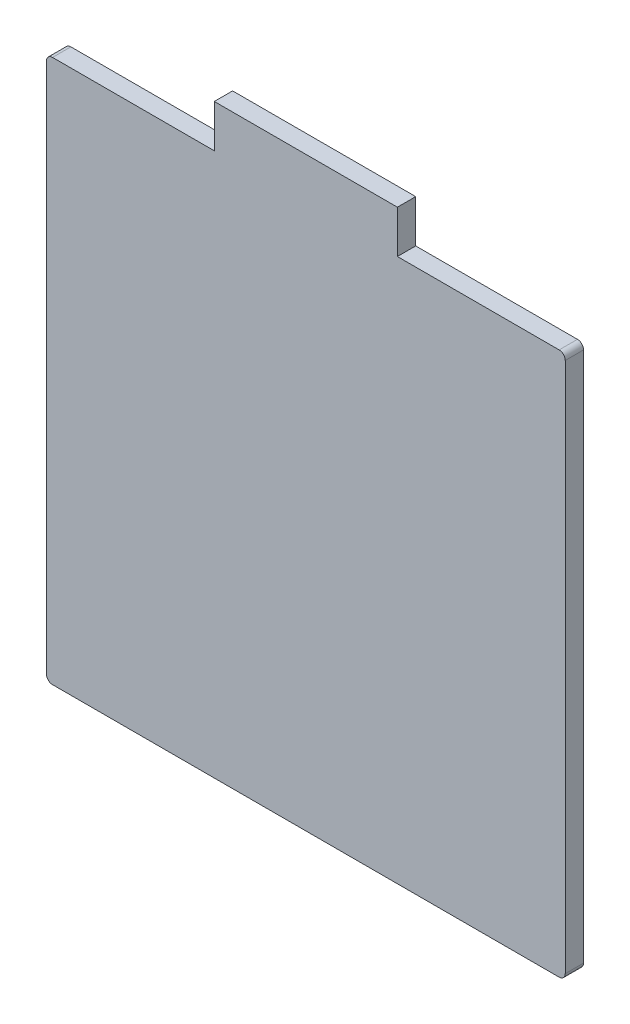
from build123d import *

# Parameters (mm, degrees)
SKETCH1_W           = 890
SKETCH1_H           = 850
BOSS_EXTRUDE1_DEPTH = 30
FILLET1_R           = 10
BOSS_EXTRUDE3_DEPTH = 70


with BuildPart() as part:
    # Sketch1 → Boss-Extrude1 (new body)
    with BuildSketch(Plane(origin=(0, 0, 0), x_dir=(0, 1, 0), z_dir=(0, 0, 1))):
        Rectangle(SKETCH1_W, SKETCH1_H)
    extrude(amount=BOSS_EXTRUDE1_DEPTH)

    # Fillet1
    fillet1_edges = [part.edges().sort_by_distance(p)[0] for p in [
        (-425, -445, 15),
        (-425, 445, 15),
        (425, 445, 15),
        (425, -445, 15),
    ]]
    fillet(fillet1_edges, radius=FILLET1_R)

    # Sketch3 → Boss-Extrude3 (add)
    with BuildSketch(Plane(origin=(0, 445, 0), x_dir=(-1, 0, 0), z_dir=(0, 1, 0))):
        Polygon((0, 0), (-150, 0), (-150, 30), (150, 30), (150, 0), align=None)
    extrude(amount=BOSS_EXTRUDE3_DEPTH)


solid = part.part
